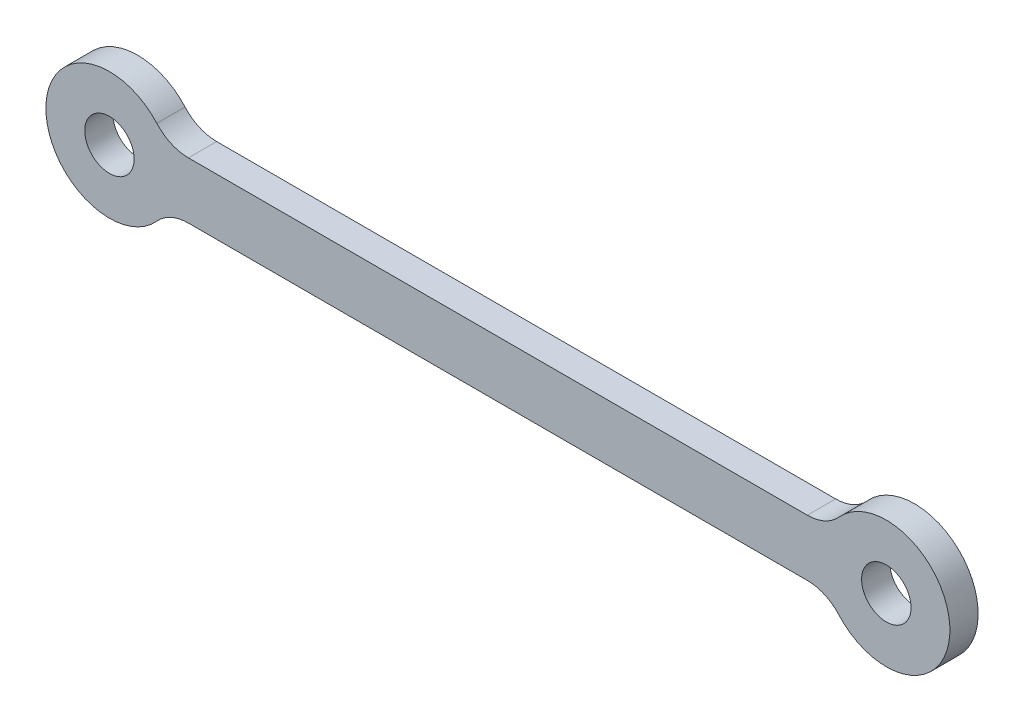
from build123d import *

# Parameters (mm, degrees)
SKETCH1_R           = 1.75
BOSS_EXTRUDE1_DEPTH = 2


with BuildPart() as part:
    # Sketch1 → Boss-Extrude1 (new body)
    with BuildSketch(Plane.XY):
        with BuildLine():
            Line((5.590169944, 2), (49.409830056, 2))
            ThreePointArc((49.409830056, 2), (50.634574928, 2.261387212), (51.645898034, 3))
            ThreePointArc((51.645898034, 3), (59.5, 0), (51.645898034, -3))
            ThreePointArc((51.645898034, -3), (50.634574928, -2.261387212), (49.409830056, -2))
            Line((49.409830056, -2), (5.590169944, -2))
            ThreePointArc((5.590169944, -2), (4.365425072, -2.261387212), (3.354101966, -3))
            ThreePointArc((3.354101966, -3), (-4.5, 0), (3.354101966, 3))
            ThreePointArc((3.354101966, 3), (4.365425072, 2.261387212), (5.590169944, 2))
        make_face()
        Circle(SKETCH1_R, mode=Mode.SUBTRACT)
        with Locations((55, 0)):
            Circle(SKETCH1_R, mode=Mode.SUBTRACT)
    extrude(amount=BOSS_EXTRUDE1_DEPTH)


solid = part.part
